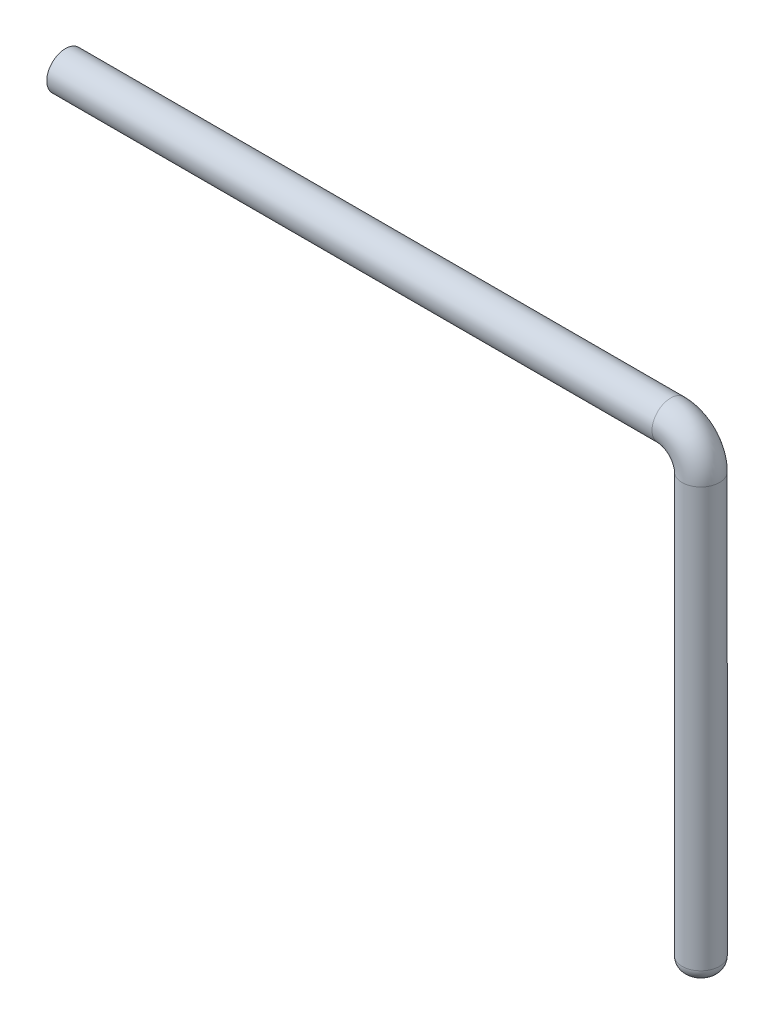
from build123d import *

# Parameters (mm, degrees)
SWEEP_1_PROFILE_R = 0.31
FILLET_4_R        = 0.2


with BuildPart() as part:
    # 扫描1: sweep along a path in 草图1
    with BuildLine(Plane.XY) as sweep_1_path:
        Line((17.078477546, 29.862829992), (27.118477546, 29.862829992))
        ThreePointArc((27.118477546, 29.862829992), (27.472030937, 29.716383383), (27.618477546, 29.362829992))
        Line((27.618477546, 29.362829992), (27.618477546, 22.212829992))
    # 扫描1 profile (on start of the path) → 扫描1 (sweep)
    with BuildSketch(Plane(origin=(17.078477546, 29.862829992, 0), x_dir=(0, 0, 1), z_dir=(1, 0, 0))):
        Circle(SWEEP_1_PROFILE_R)
    sweep(path=sweep_1_path.line)

    # 圆角4
    fillet_4_edges = [part.edges().sort_by_distance(p)[0] for p in [
        (27.618477546, 22.212829992, -0.31),
    ]]
    fillet(fillet_4_edges, radius=FILLET_4_R)


solid = part.part
